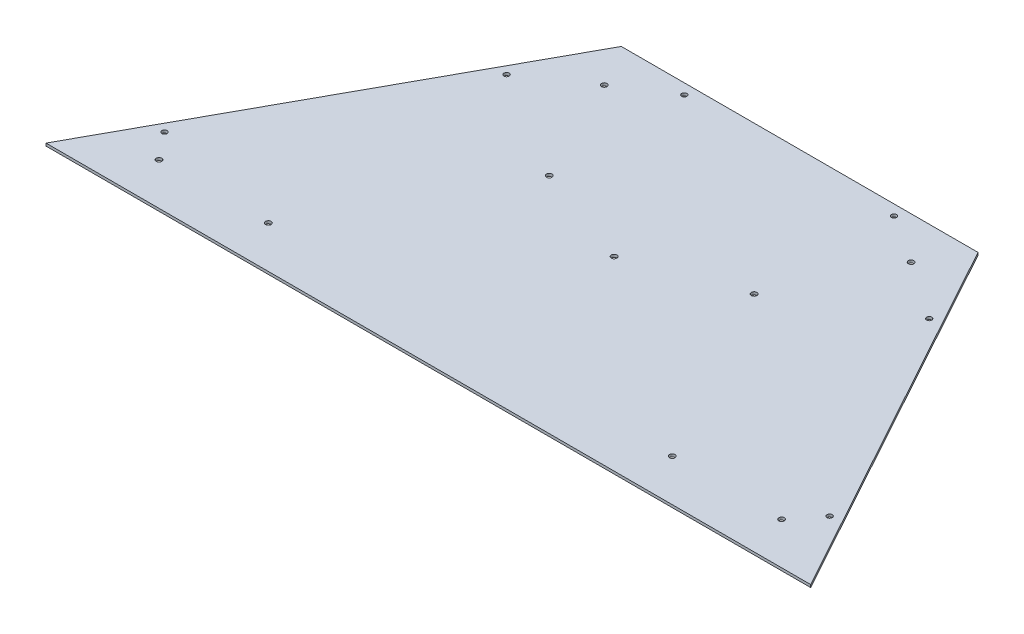
from build123d import *

# Parameters (mm, degrees)
BOSS_EXTRUDE1_DEPTH         = 3.175
F_1_4_0_25_DIAMETER_HOLE1_D = 6.35
F_1_4_CLEARANCE_HOLE1_D     = 6.7564


with BuildPart() as part:
    # Sketch1 → Boss-Extrude1 (new body)
    with BuildSketch(Plane(origin=(0, 0, 0), x_dir=(1, 0, 0), z_dir=(0, 1, 0))):
        Polygon((-462.534, 0), (-215.773, 449.26502653), (215.773, 449.26502653), (462.534, 0), align=None)
    extrude(amount=BOSS_EXTRUDE1_DEPTH)

    # 1/4 (0.25) Diameter Hole1 (through all)
    with Locations(Plane(origin=(0, 3.175, 0), x_dir=(1, 0, 0), z_dir=(0, 1, 0))):
        with Locations((-402.368285269, 83.160171278), (-255.632309055, 350.314795577), (-126.873, 436.56502653), (402.368285269, 83.160171278), (255.632309055, 350.314795577), (126.873, 436.56502653)):
            Hole(F_1_4_0_25_DIAMETER_HOLE1_D / 2)

    # 1/4 Clearance Hole1 (through all)
    with Locations(Plane(origin=(0, 3.175, 0), x_dir=(1, 0, 0), z_dir=(0, 1, 0))):
        with Locations((-376.682, 50.8), (-244.348, 50.8), (-123.952, 270.256), (-185.674, 398.526), (0, 224.79), (376.682, 50.8), (244.348, 50.8), (185.674, 398.526), (123.952, 270.256)):
            Hole(F_1_4_CLEARANCE_HOLE1_D / 2)


solid = part.part
